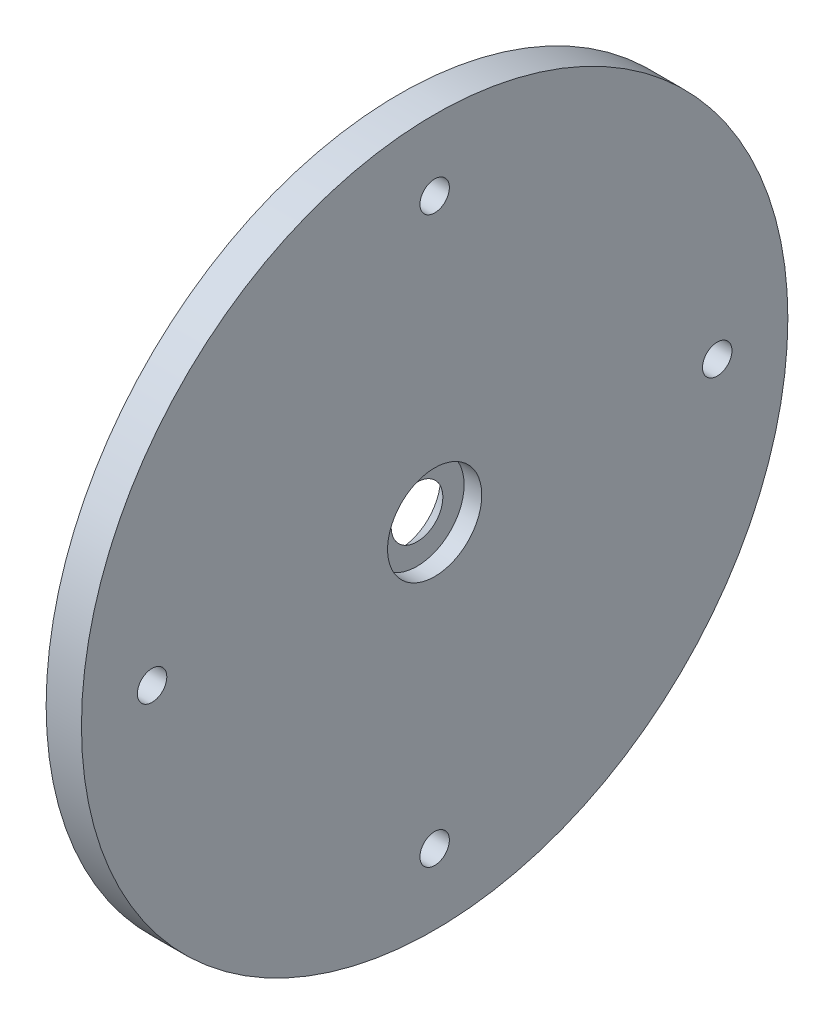
from build123d import *

# Parameters (mm, degrees)
SKETCH1_R               = 95.25
BOSS_EXTRUDE1_DEPTH     = 9.525
SKETCH2_R               = 12.7
CUT_EXTRUDE1_DEPTH      = 4.7625
F_3_8_16_TAPPED_HOLE1_D = 7.9375
CIRPATTERN1_COUNT       = 4


with BuildPart() as part:
    # Sketch1 → Boss-Extrude1 (new body)
    with BuildSketch(Plane(origin=(0, 0, 0), x_dir=(0, 0, -1), z_dir=(1, 0, 0))):
        with Locations(Location((0, 0, 0), (0, 0, 180))):
            Circle(SKETCH1_R)
    extrude(amount=BOSS_EXTRUDE1_DEPTH)

    # Sketch2 → Cut-Extrude1 (cut)
    with BuildSketch(Plane(origin=(9.525, 0, 0), x_dir=(0, 0, -1), z_dir=(1, 0, 0))):
        Circle(SKETCH2_R)
    extrude(amount=-CUT_EXTRUDE1_DEPTH, mode=Mode.SUBTRACT)

    # Sketch4 → CSK for 1/2 Flat Head Machine Screw1 (revolve, cut)
    with BuildSketch(Plane.ZX):
        Polygon((0, 0), (0, 9.525), (6.74624, 9.525), (6.74624, 5.022807562), (11.1125, 0), align=None)
    revolve(axis=Axis((-6.35, 0, 0), (1, 0, 0)), mode=Mode.SUBTRACT)

    # 3/8-16 Tapped Hole1 (through all)
    with Locations(Plane(origin=(9.525, 0, 0), x_dir=(0, 0, -1), z_dir=(1, 0, 0))):
        with Locations((0, -76.2)):
            f_3_8_16_tapped_hole1 = Hole(F_3_8_16_TAPPED_HOLE1_D / 2)

    # CirPattern1: 3/8-16 Tapped Hole1 ×4 about axis
    cirpattern1_axis = Axis((0, 0, 0), (1, 0, 0))
    for i in range(1, CIRPATTERN1_COUNT):
        add(f_3_8_16_tapped_hole1.rotate(cirpattern1_axis, i * 360 / CIRPATTERN1_COUNT), mode=Mode.SUBTRACT)


solid = part.part
